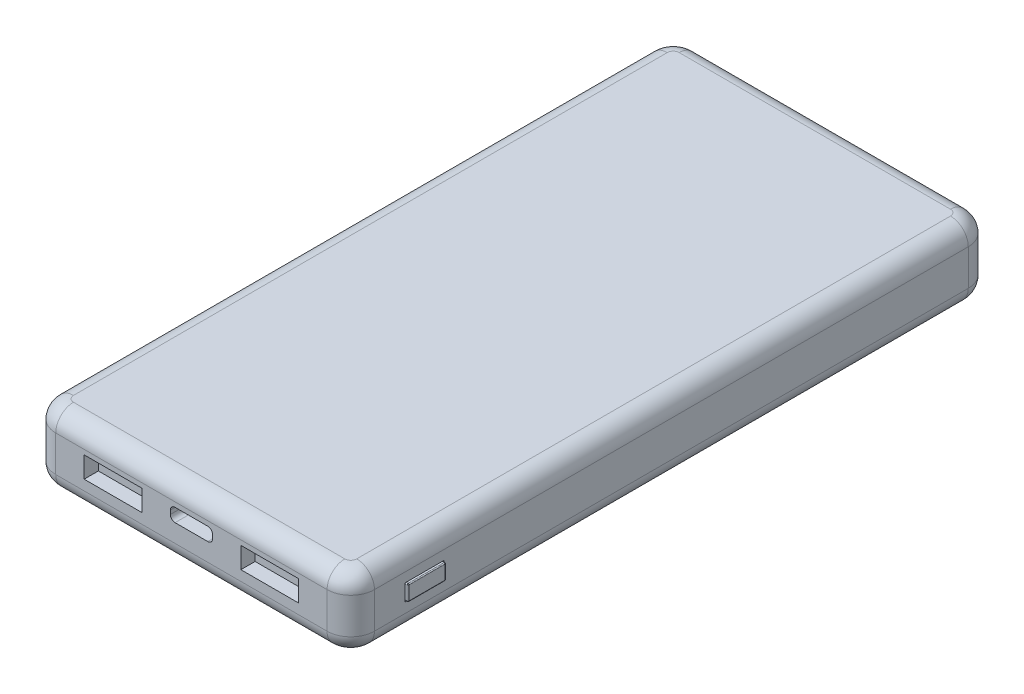
from build123d import *

# Parameters (mm, degrees)
SKETCH1_W           = 67.3
SKETCH1_H           = 135.4
BOSS_EXTRUDE1_DEPTH = 15.1
FILLET1_R           = 5
FILLET2_R           = 3.75
SKETCH2_W           = 12.2
SKETCH2_H           = 4.45
CUT_EXTRUDE1_DEPTH  = 3
SKETCH3_W           = 8.2
SKETCH3_H           = 3.5
SKETCH3_W_2         = 8
SKETCH3_H_2         = 3.3
CUT_EXTRUDE2_DEPTH  = 3
FILLET3_R           = 3.75
SKETCH4_W           = 8
SKETCH4_H           = 3.3
BOSS_EXTRUDE2_DEPTH = 0.5
FILLET4_R           = 0.2
FILLET5_R           = 0.2


with BuildPart() as part:
    # Sketch1 → Boss-Extrude1 (new body)
    with BuildSketch(Plane(origin=(0, 0, 0), x_dir=(1, 0, 0), z_dir=(0, 1, 0))):
        with Locations((33.65, 67.7)):
            Rectangle(SKETCH1_W, SKETCH1_H)
    extrude(amount=BOSS_EXTRUDE1_DEPTH)

    # Fillet1
    fillet1_edges = [part.edges().sort_by_distance(p)[0] for p in [
        (0, 7.55, -135.4),
        (67.3, 7.55, -135.4),
        (67.3, 7.55, 0),
        (0, 7.55, 0),
    ]]
    fillet(fillet1_edges, radius=FILLET1_R)

    # Fillet2
    fillet2_edges = [part.edges().sort_by_distance(p)[0] for p in [
        (0, 15.1, -67.7),
        (33.65, 15.1, -135.4),
        (33.65, 15.1, 0),
        (67.3, 15.1, -67.7),
        (1.464466094, 15.1, -1.464466094),
        (65.835533906, 15.1, -1.464466094),
        (65.835533906, 15.1, -133.935533906),
        (1.464466094, 15.1, -133.935533906),
    ]]
    fillet(fillet2_edges, radius=FILLET2_R)

    # Sketch2 → Cut-Extrude1 (cut)
    with BuildSketch(Plane.XY):
        with Locations((17.1, 8.125)):
            Rectangle(SKETCH2_W, SKETCH2_H)
        with Locations((50.2, 8.125)):
            Rectangle(SKETCH2_W, SKETCH2_H)
        with BuildLine():
            Line((30.2, 7.55), (37.1, 7.55))
            ThreePointArc((37.1, 7.55), (37.807106781, 7.842893219), (38.1, 8.55))
            Line((38.1, 8.55), (38.1, 9.35))
            ThreePointArc((38.1, 9.35), (37.807106781, 10.057106781), (37.1, 10.35))
            Line((37.1, 10.35), (30.2, 10.35))
            ThreePointArc((30.2, 10.35), (29.492893219, 10.057106781), (29.2, 9.35))
            Line((29.2, 9.35), (29.2, 8.55))
            ThreePointArc((29.2, 8.55), (29.492893219, 7.842893219), (30.2, 7.55))
        make_face()
    extrude(amount=-CUT_EXTRUDE1_DEPTH, mode=Mode.SUBTRACT)

    # Sketch3 → Cut-Extrude2 (cut)
    with BuildSketch(Plane(origin=(67.3, 0, 0), x_dir=(0, 0, -1), z_dir=(1, 0, 0))):
        with Locations((15.6, 7.6)):
            Rectangle(SKETCH3_W, SKETCH3_H)
        with Locations((15.6, 7.6)):
            Rectangle(SKETCH3_W_2, SKETCH3_H_2, mode=Mode.SUBTRACT)
    extrude(amount=-CUT_EXTRUDE2_DEPTH, mode=Mode.SUBTRACT)

    # Fillet3
    fillet3_edges = [part.edges().sort_by_distance(p)[0] for p in [
        (0, 0, -67.7),
        (33.65, 0, -135.4),
        (67.3, 0, -67.7),
        (33.65, 0, 0),
        (1.464466094, 0, -1.464466094),
        (65.835533906, 0, -1.464466094),
        (65.835533906, 0, -133.935533906),
        (1.464466094, 0, -133.935533906),
    ]]
    fillet(fillet3_edges, radius=FILLET3_R)

    # Sketch4 → Boss-Extrude2 (add)
    with BuildSketch(Plane(origin=(67.3, 0, 0), x_dir=(0, 0, -1), z_dir=(1, 0, 0))):
        with Locations((15.6, 7.6)):
            Rectangle(SKETCH4_W, SKETCH4_H)
    extrude(amount=BOSS_EXTRUDE2_DEPTH)

    # Fillet4
    fillet4_edges = [part.edges().sort_by_distance(p)[0] for p in [
        (66.05, 9.25, -11.6),
        (66.05, 9.25, -19.6),
        (66.05, 5.95, -19.6),
        (66.05, 5.95, -11.6),
    ]]
    fillet(fillet4_edges, radius=FILLET4_R)

    # Fillet5
    fillet5_edges = [part.edges().sort_by_distance(p)[0] for p in [
        (67.8, 7.6, -11.6),
        (67.8, 5.95, -15.6),
        (67.8, 7.6, -19.6),
        (67.8, 9.25, -15.6),
        (67.8, 9.191421356, -11.658578644),
        (67.8, 9.191421356, -19.541421356),
        (67.8, 6.008578644, -19.541421356),
        (67.8, 6.008578644, -11.658578644),
    ]]
    fillet(fillet5_edges, radius=FILLET5_R)


solid = part.part
